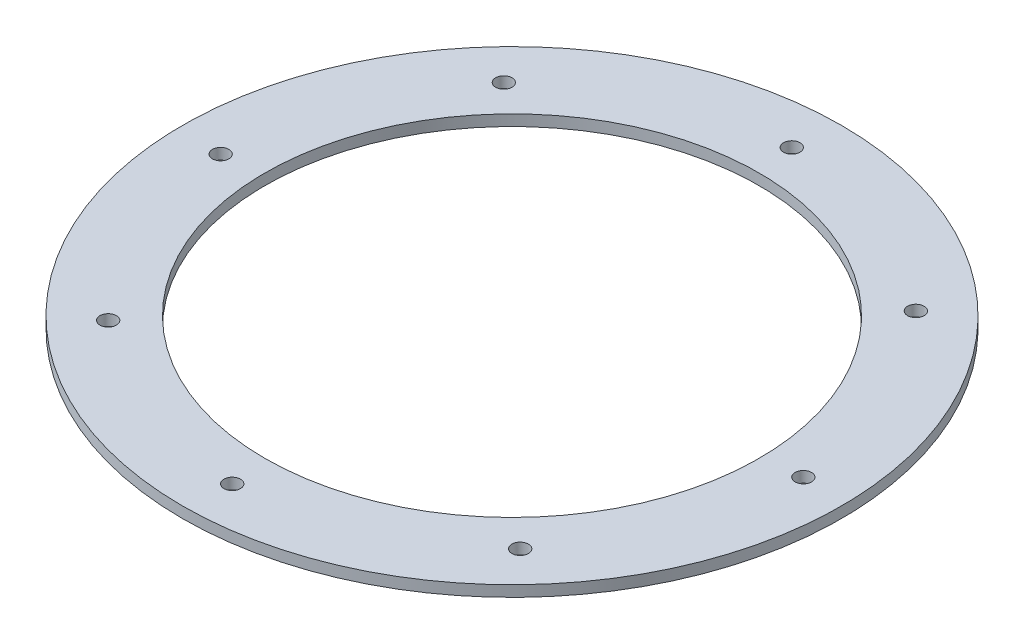
from build123d import *

# Parameters (mm, degrees)
SKETCH_1_R               = 60
SKETCH_1_R_2             = 45
EXTRUDE_1_DEPTH          = 2
SKETCH_2_R               = 1.5
CUT_EXTRUDE_1_DEPTH      = 50
PATTERN_CIRCULAR_1_COUNT = 8


with BuildPart() as part:
    # 草图1 → 凸台-拉伸1 (new body)
    with BuildSketch(Plane(origin=(0, 0, 0), x_dir=(1, 0, 0), z_dir=(0, 1, 0))):
        with Locations(Location((0, 0, 0), (0, 0, 270))):
            Circle(SKETCH_1_R)
        with Locations(Location((0, 0, 0), (0, 0, 270))):
            Circle(SKETCH_1_R_2, mode=Mode.SUBTRACT)
    extrude(amount=EXTRUDE_1_DEPTH)

    # 草图2 → 切除-拉伸1 (cut)
    with BuildSketch(Plane.XZ):
        with Locations(Location((-51.989320621, 1.053822248, 0), (0, 0, 270))):
            Circle(SKETCH_2_R)
    cut_extrude_1 = extrude(amount=-CUT_EXTRUDE_1_DEPTH, mode=Mode.SUBTRACT)

    # 阵列(圆周)1: 切除-拉伸1 ×8 about axis
    pattern_circular_1_axis = Axis((0, 0, 0), (0, 1, 0))
    for i in range(1, PATTERN_CIRCULAR_1_COUNT):
        add(cut_extrude_1.rotate(pattern_circular_1_axis, i * 360 / PATTERN_CIRCULAR_1_COUNT), mode=Mode.SUBTRACT)


solid = part.part
